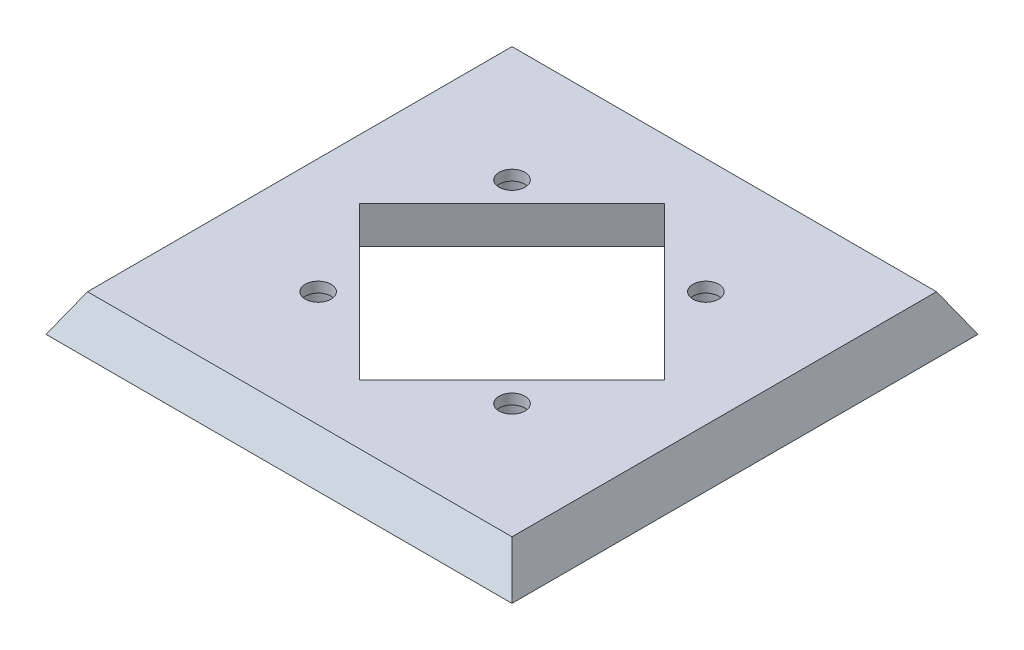
from build123d import *

# Parameters (mm, degrees)
BOSS_EXTRUDE1_DEPTH      = 60.1
BOSS_EXTRUDE1_DEPTH_BACK = 60.1
CUT_EXTRUDE3_DEPTH       = 86.526286164
CUT_EXTRUDE3_DEPTH_BACK  = 86.526286164
SKETCH2_R                = 3.34
CUT_EXTRUDE5_DEPTH       = 86.526286164
SKETCH8_R                = 5.08
CUT_EXTRUDE6_DEPTH       = 6.858


with BuildPart() as part:
    # Sketch5 → Boss-Extrude1 (new, two sides: drawn at the far end of the back side and taken through both)
    with BuildSketch(Plane(origin=(0, 0, 0), x_dir=(0, 0, -1), z_dir=(1, 0, 0)).offset(-BOSS_EXTRUDE1_DEPTH_BACK)):
        Polygon((60.1, 0), (-60.1, 0), (-54.75, 9.525), (54.75, 9.525), align=None)
    extrude(amount=BOSS_EXTRUDE1_DEPTH + BOSS_EXTRUDE1_DEPTH_BACK)

    # Sketch6 → Cut-Extrude3 (cut, two sides: drawn at the far end of the back side and taken through both)
    with BuildSketch(Plane.XY.offset(-CUT_EXTRUDE3_DEPTH_BACK)):
        Polygon((-54.75, 9.525), (-60.1, 0), (-60.1, 9.525), align=None)
        Polygon((60.1, 9.525), (54.75, 9.525), (60.1, 0), align=None)
    extrude(amount=CUT_EXTRUDE3_DEPTH + CUT_EXTRUDE3_DEPTH_BACK, mode=Mode.SUBTRACT)

    # Sketch2 → Cut-Extrude5 (cut, through all)
    with BuildSketch(Plane(origin=(0, 0, 0), x_dir=(1, 0, 0), z_dir=(0, 1, 0))):
        with Locations((-25, 25)):
            Circle(SKETCH2_R)
        with Locations((25, 25)):
            Circle(SKETCH2_R)
        with Locations((25, -25)):
            Circle(SKETCH2_R)
        with Locations((-25, -25)):
            Circle(SKETCH2_R)
        Polygon((-39.357563441, 0), (0, 39.357563441), (39.357563441, 0), (0, -39.357563441), align=None)
    extrude(amount=CUT_EXTRUDE5_DEPTH, mode=Mode.SUBTRACT)

    # Sketch8 → Cut-Extrude6 (cut)
    with BuildSketch(Plane.XZ):
        with Locations((-25, 25)):
            Circle(SKETCH8_R)
        with Locations((25, 25)):
            Circle(SKETCH8_R)
        with Locations((25, -25)):
            Circle(SKETCH8_R)
        with Locations((-25, -25)):
            Circle(SKETCH8_R)
    extrude(amount=-CUT_EXTRUDE6_DEPTH, mode=Mode.SUBTRACT)


solid = part.part
